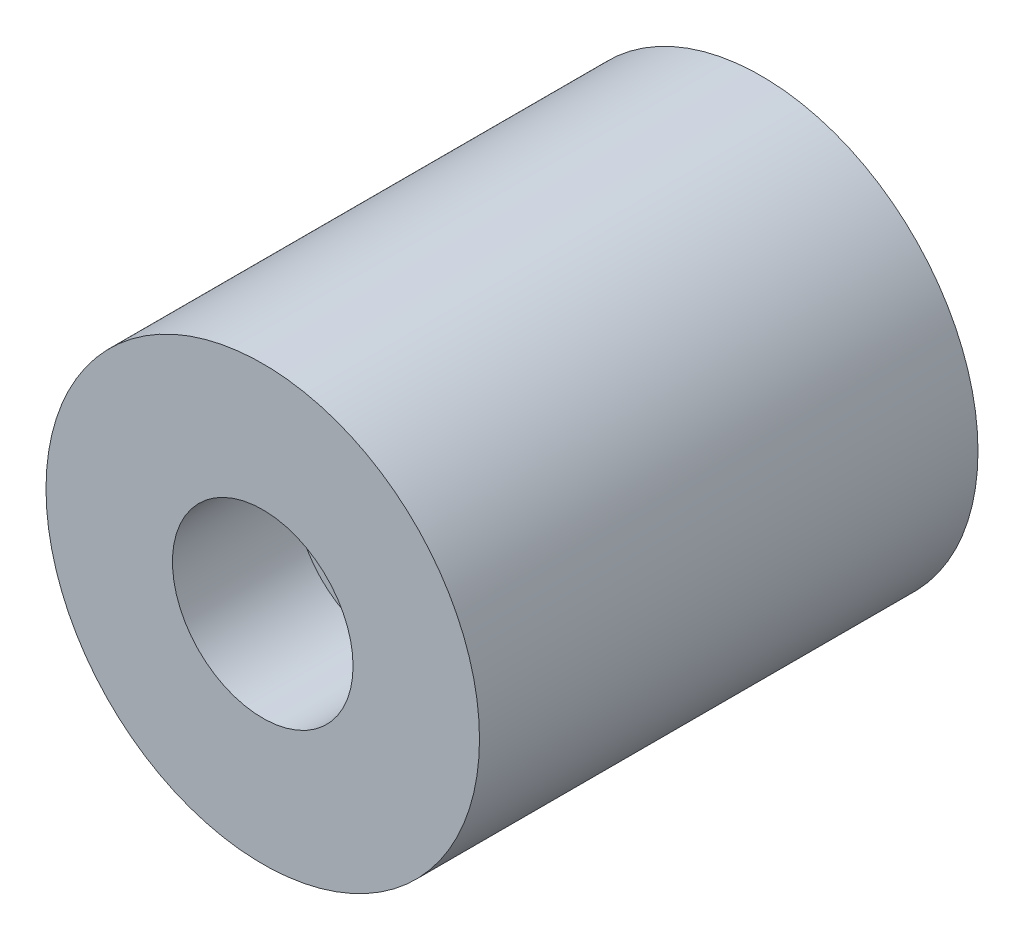
from build123d import *

# Parameters (mm, degrees)
SKETCH2_R            = 30
BOSS_EXTRUDE2_DEPTH  = 40.09
BOSS_EXTRUDE4_START  = 27.91
SKETCH4_R            = 30
BOSS_EXTRUDE4_DEPTH  = 27.91
SKETCH6_R            = 12.5
CUT_EXTRUDE1_DEPTH   = 19
SKETCH7_R            = 9.25
CUT_EXTRUDE2_DEPTH   = 65.815121692
CUT_EXTRUDE3_START   = -1
SKETCH8_R            = 30
SKETCH8_R_2          = 9.25
CUT_EXTRUDE3_DEPTH   = 1
CUT_EXTRUDE4_START   = -1.21
SKETCH9_R            = 30
SKETCH9_R_2          = 9.25
CUT_EXTRUDE4_DEPTH   = 1.21
SKETCH10_R           = 30
BOSS_EXTRUDE5_DEPTH  = 1
BOSS_EXTRUDE6_START  = 2
SKETCH11_R           = 9.25
BOSS_EXTRUDE6_DEPTH  = 2
SKETCH12_R           = 6.5
BOSS_EXTRUDE7_DEPTH  = 7.205952714
CUT_EXTRUDE5_START   = -5
SKETCH14_R           = 6.5
SKETCH14_R_2         = 5
CUT_EXTRUDE5_DEPTH   = 5
SKETCH15_R           = 3.25
CUT_EXTRUDE6_DEPTH   = 77.610469911
SKETCH16_R           = 30
SKETCH16_R_2         = 6.5
BOSS_EXTRUDE8_DEPTH  = 0.21
SKETCH17_R           = 30
SKETCH17_R_2         = 6.5
BOSS_EXTRUDE9_DEPTH  = 1.995952714
BOSS_EXTRUDE10_START = 0.79
SKETCH18_R           = 9.25
SKETCH18_R_2         = 3.25
BOSS_EXTRUDE10_DEPTH = 0.79
SKETCH19_R           = 9.25
SKETCH19_R_2         = 3.25
CUT_EXTRUDE7_DEPTH   = 1
BOSS_EXTRUDE11_START = 2
SKETCH21_R           = 12.5
SKETCH21_R_2         = 9.25
BOSS_EXTRUDE11_DEPTH = 2


with BuildPart() as part:
    # Sketch2 → Boss-Extrude2 (new body)
    with BuildSketch(Plane.XY):
        Circle(SKETCH2_R)
    extrude(amount=-BOSS_EXTRUDE2_DEPTH)

    # Sketch4 → Boss-Extrude4 (add)
    with BuildSketch(Plane.XY.offset(BOSS_EXTRUDE4_START)):
        Circle(SKETCH4_R)
    extrude(amount=-BOSS_EXTRUDE4_DEPTH)

    # Sketch6 → Cut-Extrude1 (cut)
    with BuildSketch(Plane.XY.offset(27.91)):
        Circle(SKETCH6_R)
    extrude(amount=-CUT_EXTRUDE1_DEPTH, mode=Mode.SUBTRACT)

    # Sketch7 → Cut-Extrude2 (cut, through all)
    with BuildSketch(Plane.XY.offset(8.91)):
        Circle(SKETCH7_R)
    extrude(amount=-CUT_EXTRUDE2_DEPTH, mode=Mode.SUBTRACT)

    # Sketch8 → Cut-Extrude3 (cut)
    with BuildSketch(Plane(origin=(0, 0, -40.09), x_dir=(-1, 0, 0), z_dir=(0, 0, -1)).offset(CUT_EXTRUDE3_START)):
        with Locations(Location((0, 0, 0), (0, 0, 180))):
            Circle(SKETCH8_R)
        with Locations(Location((0, 0, 0), (0, 0, 180))):
            Circle(SKETCH8_R_2, mode=Mode.SUBTRACT)
    extrude(amount=CUT_EXTRUDE3_DEPTH, mode=Mode.SUBTRACT)

    # Sketch9 → Cut-Extrude4 (cut)
    with BuildSketch(Plane(origin=(0, 0, -39.09), x_dir=(-1, 0, 0), z_dir=(0, 0, -1)).offset(CUT_EXTRUDE4_START)):
        with Locations(Location((0, 0, 0), (0, 0, 180))):
            Circle(SKETCH9_R)
        with Locations(Location((0, 0, 0), (0, 0, 180))):
            Circle(SKETCH9_R_2, mode=Mode.SUBTRACT)
    extrude(amount=CUT_EXTRUDE4_DEPTH, mode=Mode.SUBTRACT)

    # Sketch10 → Boss-Extrude5 (add)
    with BuildSketch(Plane(origin=(0, 0, -37.88), x_dir=(-1, 0, 0), z_dir=(0, 0, -1))):
        with Locations(Location((0, 0, 0), (0, 0, 180))):
            Circle(SKETCH10_R)
    extrude(amount=BOSS_EXTRUDE5_DEPTH)

    # Sketch11 → Boss-Extrude6 (add)
    with BuildSketch(Plane.XY.offset(-37.88).offset(BOSS_EXTRUDE6_START)):
        Circle(SKETCH11_R)
    extrude(amount=-BOSS_EXTRUDE6_DEPTH)

    # Sketch12 → Boss-Extrude7 (add)
    with BuildSketch(Plane(origin=(0, 0, -38.88), x_dir=(-1, 0, 0), z_dir=(0, 0, -1))):
        with Locations(Location((0, 0, 0), (0, 0, 180))):
            Circle(SKETCH12_R)
    extrude(amount=BOSS_EXTRUDE7_DEPTH)

    # Sketch14 → Cut-Extrude5 (cut)
    with BuildSketch(Plane(origin=(0, 0, -46.085952714), x_dir=(-1, 0, 0), z_dir=(0, 0, -1)).offset(CUT_EXTRUDE5_START)):
        Circle(SKETCH14_R)
        Circle(SKETCH14_R_2, mode=Mode.SUBTRACT)
    extrude(amount=CUT_EXTRUDE5_DEPTH, mode=Mode.SUBTRACT)

    # Sketch15 → Cut-Extrude6 (cut, through all)
    with BuildSketch(Plane.XY.offset(-35.88)):
        Circle(SKETCH15_R)
    extrude(amount=-CUT_EXTRUDE6_DEPTH, mode=Mode.SUBTRACT)

    # Sketch16 → Boss-Extrude8 (add)
    with BuildSketch(Plane(origin=(0, 0, -38.88), x_dir=(-1, 0, 0), z_dir=(0, 0, -1))):
        with Locations(Location((0, 0, 0), (0, 0, 180))):
            Circle(SKETCH16_R)
        Circle(SKETCH16_R_2, mode=Mode.SUBTRACT)
    extrude(amount=BOSS_EXTRUDE8_DEPTH)

    # Sketch17 → Boss-Extrude9 (add)
    with BuildSketch(Plane(origin=(0, 0, -39.09), x_dir=(-1, 0, 0), z_dir=(0, 0, -1))):
        with Locations(Location((0, 0, 0), (0, 0, 180))):
            Circle(SKETCH17_R)
        Circle(SKETCH17_R_2, mode=Mode.SUBTRACT)
    extrude(amount=BOSS_EXTRUDE9_DEPTH)

    # Sketch18 → Boss-Extrude10 (add)
    with BuildSketch(Plane.XY.offset(-35.88).offset(BOSS_EXTRUDE10_START)):
        Circle(SKETCH18_R)
        Circle(SKETCH18_R_2, mode=Mode.SUBTRACT)
    extrude(amount=-BOSS_EXTRUDE10_DEPTH)

    # Sketch19 → Cut-Extrude7 (cut)
    with BuildSketch(Plane.XY.offset(-35.09)):
        Circle(SKETCH19_R)
        Circle(SKETCH19_R_2, mode=Mode.SUBTRACT)
    extrude(amount=-CUT_EXTRUDE7_DEPTH, mode=Mode.SUBTRACT)

    # Sketch21 → Boss-Extrude11 (add)
    with BuildSketch(Plane.XY.offset(8.91).offset(BOSS_EXTRUDE11_START)):
        Circle(SKETCH21_R)
        Circle(SKETCH21_R_2, mode=Mode.SUBTRACT)
    extrude(amount=-BOSS_EXTRUDE11_DEPTH)


solid = part.part
